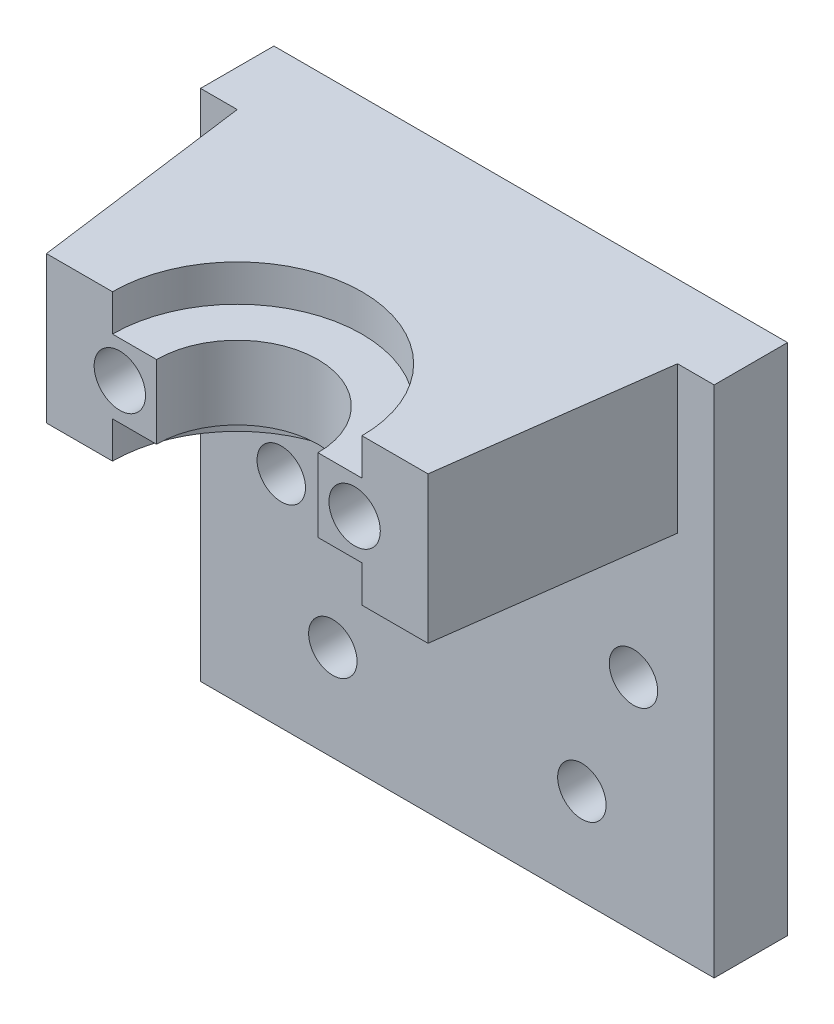
from build123d import *

# Parameters (mm, degrees)
ESBO_O1_W                  = 50
ESBO_O1_H                  = 50
ESBO_O1_R                  = 1.65
RESSALTO_EXTRUS_O1_DEPTH   = 5
RESSALTO_EXTRUS_O2_START   = 15
RESSALTO_EXTRUS_O2_DEPTH   = 5
ESBO_O4_W                  = 8.5
ESBO_O4_H                  = 2.5
CORTE_EXTRUS_O1_DEPTH      = 39.405728739
CORTE_EXTRUS_O1_DEPTH_BACK = 39.405728739
ESBO_O5_W                  = 50
ESBO_O5_H                  = 50
ESBO_O5_W_2                = 35
ESBO_O5_H_2                = 35
ESBO_O6_R                  = 1.75
CORTE_EXTRUS_O2_DEPTH      = 34.260336739


with BuildPart() as part:
    # Esboço1 → Ressalto-extrusão1 (new body)
    with BuildSketch(Plane.XY):
        Rectangle(ESBO_O1_W, ESBO_O1_H)
        with Locations((12, 0)):
            Circle(ESBO_O1_R, mode=Mode.SUBTRACT)
        with Locations((8.485281374, -8.485281374)):
            Circle(ESBO_O1_R, mode=Mode.SUBTRACT)
        with Locations((-8.485281374, -8.485281374)):
            Circle(ESBO_O1_R, mode=Mode.SUBTRACT)
        with Locations((-12, 0)):
            Circle(ESBO_O1_R, mode=Mode.SUBTRACT)
        with Locations((-8.485281374, 8.485281374)):
            Circle(ESBO_O1_R, mode=Mode.SUBTRACT)
        with Locations((8.485281374, 8.485281374)):
            Circle(ESBO_O1_R, mode=Mode.SUBTRACT)
    extrude(amount=RESSALTO_EXTRUS_O1_DEPTH)

    # Esboço2 → Ressalto-extrusão2 (add, symmetric)
    with BuildSketch(Plane(origin=(0, 0, 0), x_dir=(1, 0, 0), z_dir=(0, 1, 0)).offset(RESSALTO_EXTRUS_O2_START)):
        with BuildLine():
            Line((13, -20), (15, -5))
            Line((15, -5), (-15, -5))
            Line((-15, -5), (-13, -20))
            Line((-13, -20), (-5.5, -20))
            ThreePointArc((-5.5, -20), (0, -14.5), (5.5, -20))
            Line((5.5, -20), (13, -20))
        make_face()
    extrude(amount=RESSALTO_EXTRUS_O2_DEPTH, both=True)

    # Esboço4 → Corte-Revolução3 (revolve, cut)
    with BuildSketch(Plane(origin=(0, 0, 0), x_dir=(0, 0, -1), z_dir=(1, 0, 0))):
        with Locations((-15.75, 18.75)):
            Rectangle(ESBO_O4_W, ESBO_O4_H)
        with Locations((-15.75, 11.25)):
            Rectangle(ESBO_O4_W, ESBO_O4_H)
    revolve(axis=Axis((0, 20, 20), (0, -1, 0)), mode=Mode.SUBTRACT)

    # Esboço5 → Corte-extrusão1 (cut, two sides: drawn at the far end of the back side and taken through both)
    with BuildSketch(Plane.XY.offset(5).offset(-CORTE_EXTRUS_O1_DEPTH_BACK)):
        Rectangle(ESBO_O5_W, ESBO_O5_H)
        with Locations((0, 2.5)):
            Rectangle(ESBO_O5_W_2, ESBO_O5_H_2, mode=Mode.SUBTRACT)
    extrude(amount=CORTE_EXTRUS_O1_DEPTH + CORTE_EXTRUS_O1_DEPTH_BACK, mode=Mode.SUBTRACT)

    # Esboço6 → Corte-extrusão2 (cut, through all)
    with BuildSketch(Plane.XY.offset(20)):
        with Locations((-8, 15)):
            Circle(ESBO_O6_R)
        with Locations((8, 15)):
            Circle(ESBO_O6_R)
    extrude(amount=-CORTE_EXTRUS_O2_DEPTH, mode=Mode.SUBTRACT)


solid = part.part
